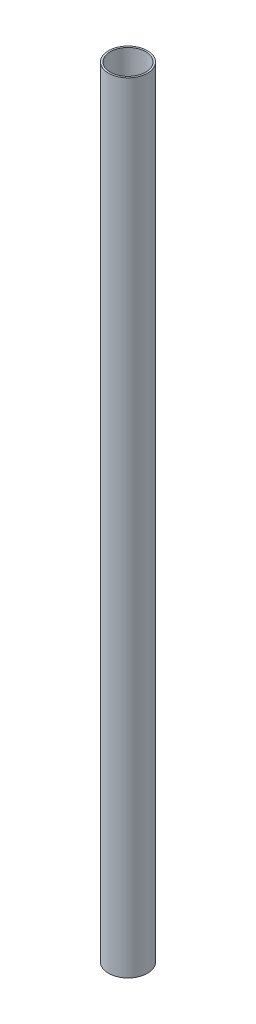
from build123d import *

# Parameters (mm, degrees)
SKETCH1_R      = 11
SKETCH1_R_2    = 10
EXTRUDE1_DEPTH = 220


with BuildPart() as part:
    # Sketch1 → Extrude1 (new, symmetric)
    with BuildSketch(Plane(origin=(0, 0, 0), x_dir=(1, 0, 0), z_dir=(0, 1, 0))):
        with Locations(Location((0, 0, 0), (0, 0, 270))):
            Circle(SKETCH1_R)
        with Locations(Location((0, 0, 0), (0, 0, 270))):
            Circle(SKETCH1_R_2, mode=Mode.SUBTRACT)
    extrude(amount=EXTRUDE1_DEPTH, both=True)


solid = part.part
